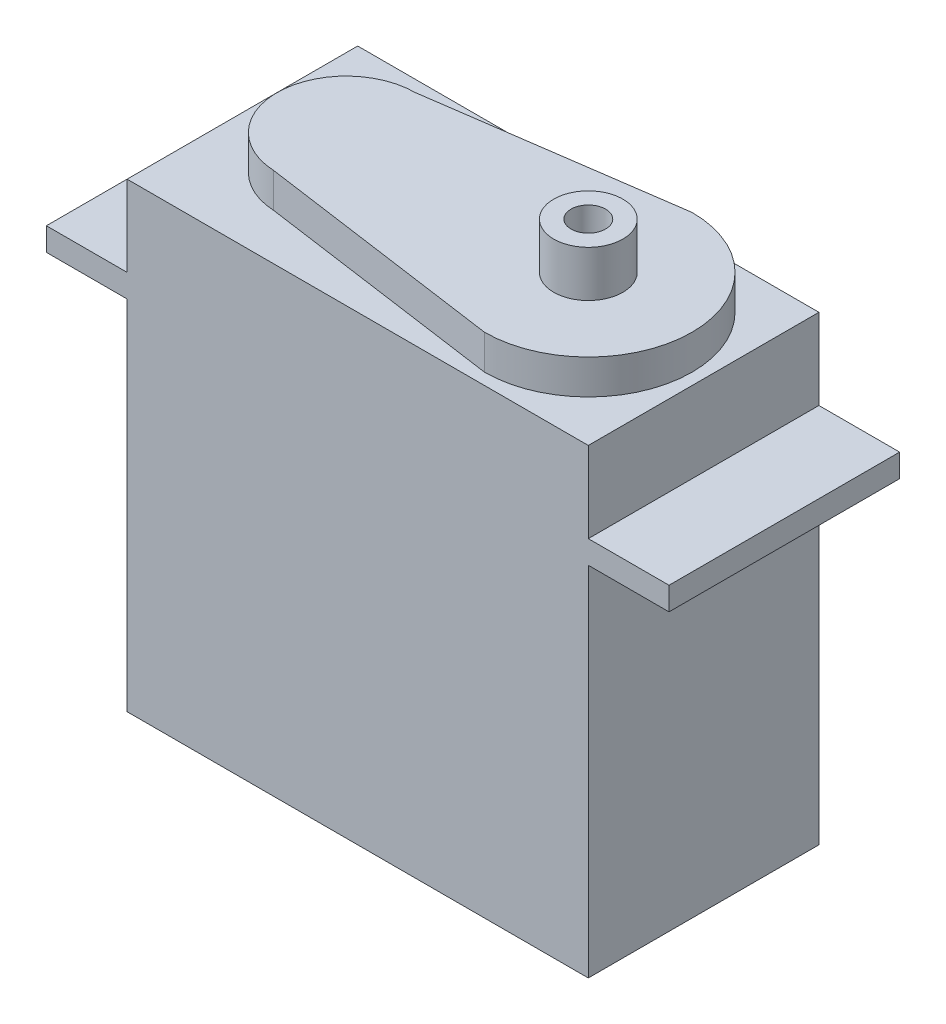
from build123d import *

# Parameters (mm, degrees)
SKETCH_1_W      = 40
SKETCH_1_H      = 40
EXTRUDE_1_DEPTH = 20
EXTRUDE_2_DEPTH = 3
SKETCH_5_R      = 3
SKETCH_5_R_2    = 1.5
EXTRUDE_3_DEPTH = 4
SKETCH_6_W      = 7
SKETCH_6_H      = 2
EXTRUDE_4_DEPTH = 20


with BuildPart() as part:
    # 草图1 → 凸台-拉伸1 (new body)
    with BuildSketch(Plane.XY):
        Rectangle(SKETCH_1_W, SKETCH_1_H)
    extrude(amount=EXTRUDE_1_DEPTH)

    # 草图2 → 凸台-拉伸2 (add)
    with BuildSketch(Plane(origin=(0, 20, 0), x_dir=(1, 0, 0), z_dir=(0, 1, 0))):
        with BuildLine():
            Line((10, -1), (-11, -4))
            ThreePointArc((-11, -4), (-16.99824603, -9.854932566), (-11.290050053, -15.992985147))
            Line((-11.290050053, -15.992985147), (10, -19))
            ThreePointArc((10, -19), (19, -10), (10, -1))
        make_face()
    extrude(amount=EXTRUDE_2_DEPTH)

    # 草图5 → 凸台-拉伸3 (add)
    with BuildSketch(Plane(origin=(0, 23, 0), x_dir=(1, 0, 0), z_dir=(0, 1, 0))):
        with Locations(Location((10, -10, 0), (0, 0, 270))):
            Circle(SKETCH_5_R)
        with Locations(Location((10, -10, 0), (0, 0, 270))):
            Circle(SKETCH_5_R_2, mode=Mode.SUBTRACT)
    extrude(amount=EXTRUDE_3_DEPTH)

    # 草图6 → 凸台-拉伸4 (add)
    with BuildSketch(Plane(origin=(0, 0, 0), x_dir=(-1, 0, 0), z_dir=(0, 0, -1))):
        with Locations((-23.5, 12)):
            Rectangle(SKETCH_6_W, SKETCH_6_H)
        with Locations((23.5, 12)):
            Rectangle(SKETCH_6_W, SKETCH_6_H)
    extrude(amount=-EXTRUDE_4_DEPTH)


solid = part.part
